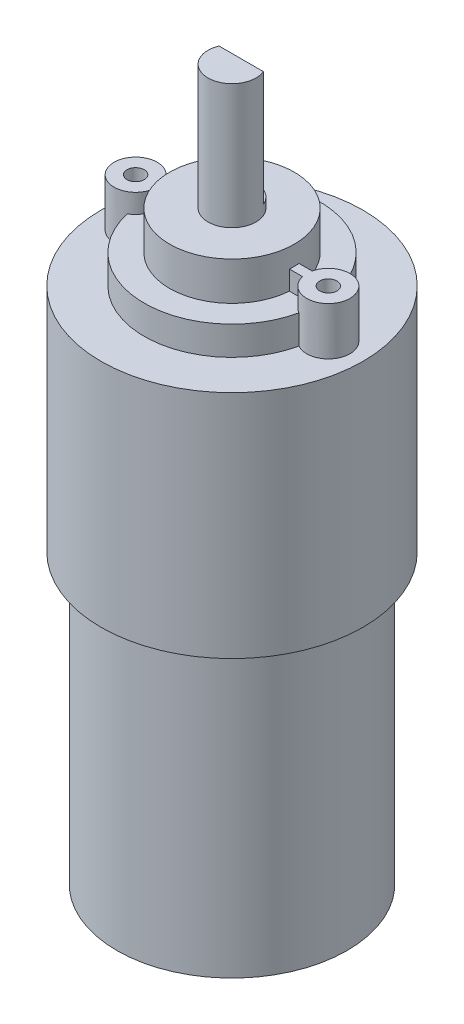
from build123d import *

# Parameters (mm, degrees)
CROQUIS1_W              = 2.5
CROQUIS1_H              = 13
CORTAR_EXTRUIR1_DEPTH   = 12
CROQUIS4_R              = 2.25
CROQUIS4_R_2            = 0.9
CROQUIS4_W              = 18
CROQUIS4_H              = 1
SALIENTE_EXTRUIR1_DEPTH = 5


with BuildPart() as part:
    # Croquis1 → Revolución1 (revolve)
    with BuildSketch(Plane.XY, mode=Mode.PRIVATE) as revoluci_n1_sk:
        with Locations((-1.25, 37)):
            Rectangle(CROQUIS1_W, CROQUIS1_H)
        Polygon((-12, -30.5), (0, -30.5), (0, 30.5), (-6.5, 30.5), (-6.5, 26.5), (-9.15, 26.5), (-9.15, 23.5), (-13.65, 23.5), (-13.65, -0.5), (-12, -0.5), align=None)
    revolve(revoluci_n1_sk.sketch.rotate(Axis((0, 65.687156563, 0), (0, -1, 0)), 270), axis=Axis((0, 65.687156563, 0), (0, -1, 0)))

    # Croquis2 → Cortar-Extruir1 (cut)
    with BuildSketch(Plane(origin=(0, 43.5, 0), x_dir=(1, 0, 0), z_dir=(0, 1, 0))):
        Polygon((-55.580517034, 0.96), (-2.308332732, 0.96), (2.308332732, 0.96), (55.580517034, 0.96), (55.580517034, 107.504368605), (-55.580517034, 107.504368605), align=None)
    extrude(amount=-CORTAR_EXTRUIR1_DEPTH, mode=Mode.SUBTRACT)

    # Croquis4 → Saliente-Extruir1 (add)
    # profile 1 of 3: a face of its own
    with BuildSketch(Plane(origin=(0, 23.5, 0), x_dir=(1, 0, 0), z_dir=(0, 1, 0))):
        with Locations((-10.04, 0)):
            Circle(CROQUIS4_R)
        with Locations(Location((-10.04, 0, 0), (0, 0, 8.158462719))):
            Circle(CROQUIS4_R_2, mode=Mode.SUBTRACT)
    # profile 2 of 3: a face of its own
    with BuildSketch(Plane(origin=(0, 23.5, 0), x_dir=(1, 0, 0), z_dir=(0, 1, 0))):
        with Locations((10.04, 0)):
            Circle(CROQUIS4_R)
        with Locations(Location((10.04, 0, 0), (0, 0, 171.841537281))):
            Circle(CROQUIS4_R_2, mode=Mode.SUBTRACT)
    # profile 3 of 3: a face of its own
    with BuildSketch(Plane(origin=(0, 23.5, 0), x_dir=(1, 0, 0), z_dir=(0, 1, 0))):
        Rectangle(CROQUIS4_W, CROQUIS4_H)
    extrude(amount=SALIENTE_EXTRUIR1_DEPTH)


solid = part.part
